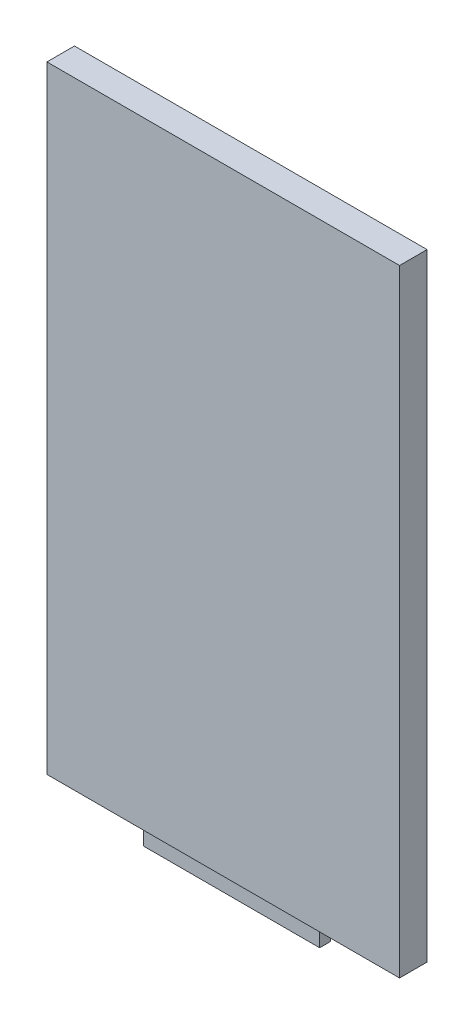
from build123d import *

# Parameters (mm, degrees)
SKETCH2_W           = 32
SKETCH2_H           = 2.5
BOSS_EXTRUDE1_DEPTH = 56
SKETCH4_W           = 16
SKETCH4_H           = 1
BOSS_EXTRUDE2_DEPTH = 2


with BuildPart() as part:
    # Sketch2 → Boss-Extrude1 (new body)
    with BuildSketch(Plane(origin=(0, 0, 0), x_dir=(1, 0, 0), z_dir=(0, 1, 0))):
        Rectangle(SKETCH2_W, SKETCH2_H)
    extrude(amount=BOSS_EXTRUDE1_DEPTH)

    # Sketch4 → Boss-Extrude2 (add)
    with BuildSketch(Plane.XZ):
        Rectangle(SKETCH4_W, SKETCH4_H)
    extrude(amount=BOSS_EXTRUDE2_DEPTH)


solid = part.part
